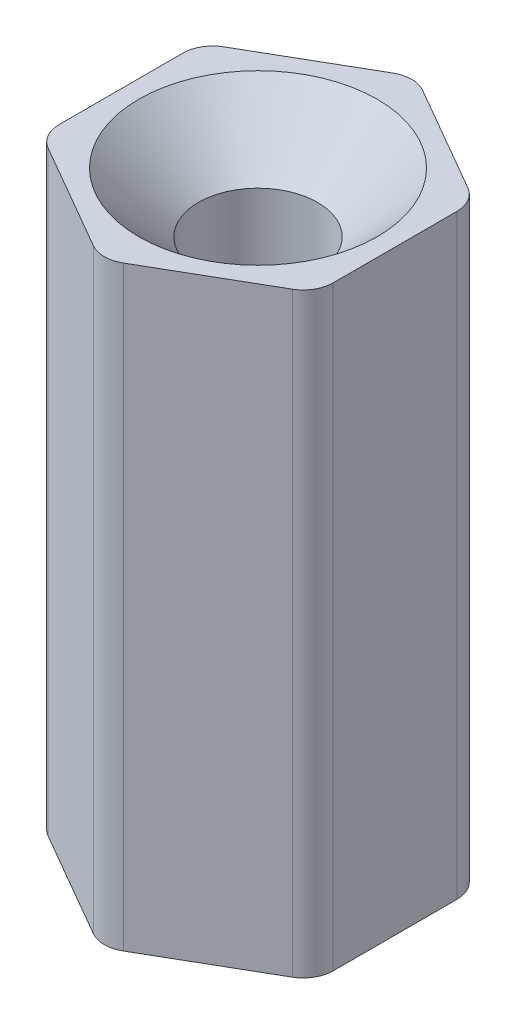
from build123d import *

# Parameters (mm, degrees)
BOSS_EXTRUDE1_DEPTH = 10
SKETCH2_R           = 1
CUT_EXTRUDE1_DEPTH  = 11.599213807
CHAMFER2_SIZE       = 1
FILLET1_R           = 0.5


with BuildPart() as part:
    # Sketch1 → Boss-Extrude1 (new body)
    with BuildSketch(Plane(origin=(0, 0, 0), x_dir=(1, 0, 0), z_dir=(0, 1, 0))):
        Polygon((0, 2.655811238), (-2.3, 1.327905619), (-2.3, -1.327905619), (0, -2.655811238), (2.3, -1.327905619), (2.3, 1.327905619), align=None)
    extrude(amount=BOSS_EXTRUDE1_DEPTH)

    # Sketch2 → Cut-Extrude1 (cut, through all)
    with BuildSketch(Plane(origin=(0, 10, 0), x_dir=(1, 0, 0), z_dir=(0, 1, 0))):
        with Locations(Location((0, 0, 0), (0, 0, 270))):
            Circle(SKETCH2_R)
    extrude(amount=-CUT_EXTRUDE1_DEPTH, mode=Mode.SUBTRACT)

    # Chamfer2
    chamfer2_edges = [part.edges().sort_by_distance(p)[0] for p in [
        (0, 0, -1),
        (0, 10, -1),
    ]]
    chamfer(chamfer2_edges, length=CHAMFER2_SIZE)

    # Fillet1
    fillet1_edges = [part.edges().sort_by_distance(p)[0] for p in [
        (2.3, 5, -1.327905619),
        (2.3, 5, 1.327905619),
        (0, 5, 2.655811238),
        (-2.3, 5, 1.327905619),
        (-2.3, 5, -1.327905619),
        (0, 5, -2.655811238),
    ]]
    fillet(fillet1_edges, radius=FILLET1_R)


solid = part.part
